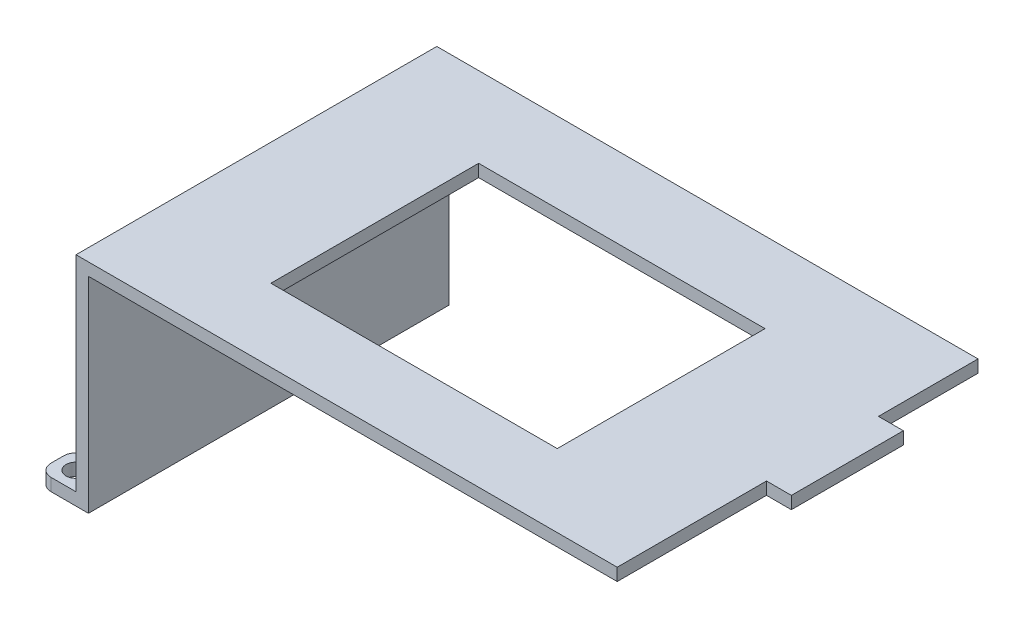
from build123d import *

# Parameters (mm, degrees)
SKETCH_1_W          = 87
SKETCH_1_H          = 58
SKETCH_1_W_2        = 4
SKETCH_1_H_2        = 18
EXTRUDE_1_DEPTH     = 2
SKETCH_2_W          = 2
SKETCH_2_H          = 58
EXTRUDE_2_DEPTH     = 33
SKETCH_3_R          = 1.6
EXTRUDE_3_DEPTH     = 2
CUT_EXTRUDE_1_REACH = 69.203
SKETCH_4_W          = 46.038149354
SKETCH_4_H          = 33.396976304


with BuildPart() as part:
    # 草图1 → 凸台-拉伸1 (new body)
    with BuildSketch(Plane(origin=(0, 0, 0), x_dir=(1, 0, 0), z_dir=(0, 1, 0))):
        Rectangle(SKETCH_1_W, SKETCH_1_H)
        with Locations((45.5, 4)):
            Rectangle(SKETCH_1_W_2, SKETCH_1_H_2)
    extrude(amount=EXTRUDE_1_DEPTH)

    # 草图2 → 凸台-拉伸2 (add)
    with BuildSketch(Plane.XZ):
        with Locations((-42.5, 0)):
            Rectangle(SKETCH_2_W, SKETCH_2_H)
    extrude(amount=EXTRUDE_2_DEPTH)

    # 草图3 → 凸台-拉伸3 (add)
    # profile 1 of 3: a face of its own
    with BuildSketch(Plane.XZ.offset(33)):
        with BuildLine():
            Line((-43.5, 23), (-43.5, 29))
            Line((-43.5, 29), (-47.5, 29))
            ThreePointArc((-47.5, 29), (-48.914213562, 28.414213562), (-49.5, 27))
            Line((-49.5, 27), (-49.5, 25))
            ThreePointArc((-49.5, 25), (-48.914213562, 23.585786438), (-47.5, 23))
            Line((-47.5, 23), (-43.5, 23))
        make_face()
        with Locations(Location((-46.5, 26, 0), (0, 0, 270))):
            Circle(SKETCH_3_R, mode=Mode.SUBTRACT)
    # profile 2 of 3: a face of its own
    with BuildSketch(Plane.XZ.offset(33)):
        Polygon((-41.5, 29), (-43.5, 29), (-43.5, 23), (-43.5, -23), (-43.5, -29), (-41.5, -29), align=None)
    # profile 3 of 3: a face of its own
    with BuildSketch(Plane.XZ.offset(33)):
        with BuildLine():
            Line((-43.5, -29), (-43.5, -23))
            Line((-43.5, -23), (-47.5, -23))
            ThreePointArc((-47.5, -23), (-48.914213562, -23.585786438), (-49.5, -25))
            Line((-49.5, -25), (-49.5, -27))
            ThreePointArc((-49.5, -27), (-48.914213562, -28.414213562), (-47.5, -29))
            Line((-47.5, -29), (-43.5, -29))
        make_face()
        with Locations(Location((-46.5, -26, 0), (0, 0, 270))):
            Circle(SKETCH_3_R, mode=Mode.SUBTRACT)
    extrude(amount=-EXTRUDE_3_DEPTH)

    # 草图4 → 切除-拉伸1 (cut, up to next)
    with BuildSketch(Plane(origin=(0, 2, 0), x_dir=(1, 0, 0), z_dir=(0, 1, 0)), mode=Mode.PRIVATE) as cut_extrude_1_sk1:
        with Locations((-0.850083312, -0.605075521)):
            Rectangle(SKETCH_4_W, SKETCH_4_H)
    cut_extrude_1_tool1 = extrude(cut_extrude_1_sk1.sketch, amount=-CUT_EXTRUDE_1_REACH, mode=Mode.PRIVATE) & part.part
    add(cut_extrude_1_tool1.solids().sort_by_distance((-0.850083, 2, 0.605076))[0], mode=Mode.SUBTRACT)


solid = part.part
